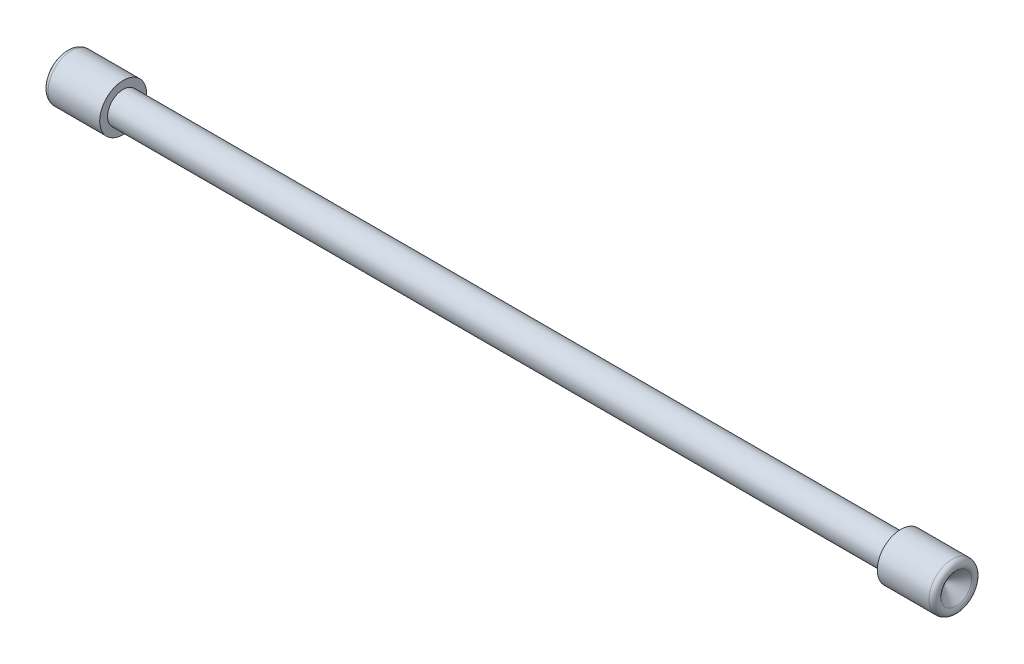
from build123d import *


with BuildPart() as part:
    # Sketch1 → Revolve1 (revolve)
    with BuildSketch(Plane.XY, mode=Mode.PRIVATE) as revolve1_sk:
        with BuildLine():
            Line((137.291796068, 0), (141.645898034, 4.868033989))
            ThreePointArc((141.645898034, 4.868033989), (141.910434206, 6.565517768), (140.468847051, 7.5))
            Line((140.468847051, 7.5), (124, 7.5))
            Line((124, 7.5), (124, 5))
            Line((124, 5), (0, 5))
            Line((0, 5), (0, 0))
            Line((0, 0), (124, 0))
            Line((124, 0), (137.291796068, 0))
        make_face()
    revolve1 = revolve(revolve1_sk.sketch.rotate(Axis((0, 0, 0), (1, 0, 0)), 90), axis=Axis((0, 0, 0), (1, 0, 0)))

    # Mirror1: Revolve1 across plane
    add(revolve1.mirror(Plane.ZY))


solid = part.part
